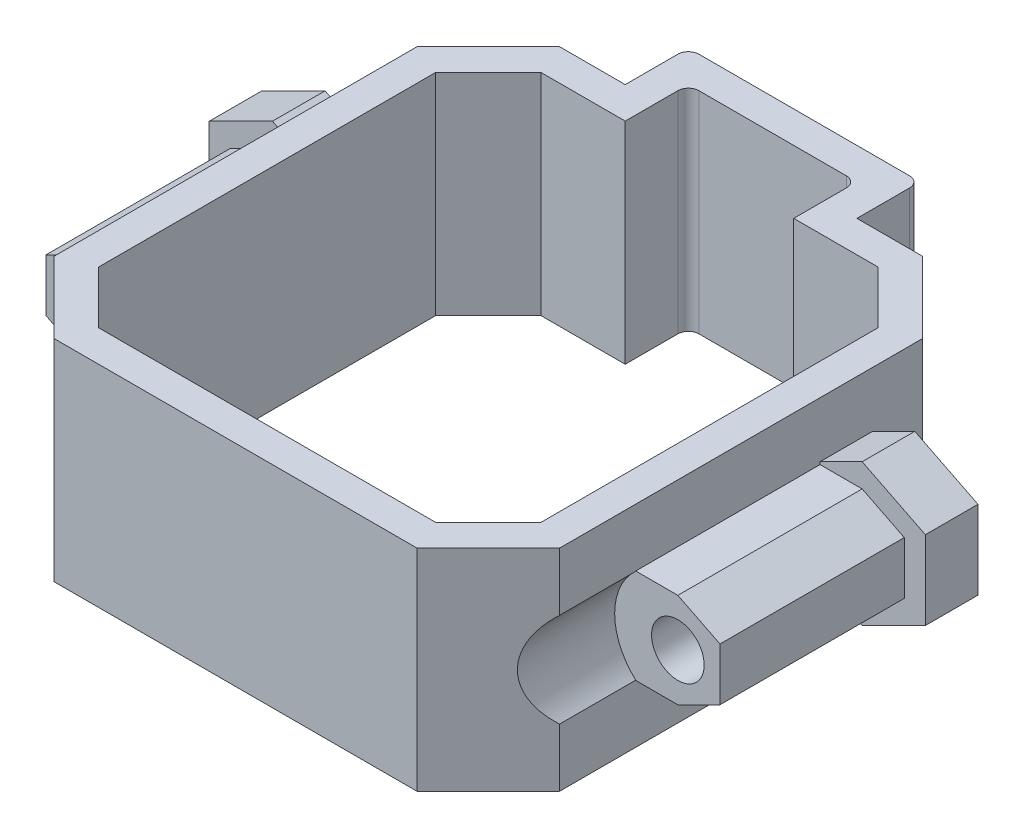
from build123d import *

# Parameters (mm, degrees)
RESSALTO_EXTRUS_O1_DEPTH = 10
RESSALTO_EXTRUS_O2_DEPTH = 10
CORTE_EXTRUS_O1_START    = 21
ESBO_O4_R                = 6
ESBO_O4_R_2              = 2.5
CORTE_EXTRUS_O1_DEPTH    = 21
RESSALTO_EXTRUS_O3_DEPTH = 2.5


with BuildPart() as part:
    # Esboço1 → Ressalto-extrusão1 (new, symmetric)
    with BuildSketch(Plane(origin=(0, 0, 0), x_dir=(1, 0, 0), z_dir=(0, 1, 0))):
        with BuildLine():
            Line((21, 16), (21, 0))
            Line((21, 0), (24, 0))
            Line((24, 0), (24, 17.242640687))
            Line((24, 17.242640687), (17.242640687, 24))
            Line((17.242640687, 24), (11, 24))
            Line((11, 24), (11, 29))
            ThreePointArc((11, 29), (10.707106781, 29.707106781), (10, 30))
            Line((10, 30), (0, 30))
            Line((0, 30), (-10, 30))
            ThreePointArc((-10, 30), (-10.707106781, 29.707106781), (-11, 29))
            Line((-11, 29), (-11, 24))
            Line((-11, 24), (-17.242640687, 24))
            Line((-17.242640687, 24), (-24, 17.242640687))
            Line((-24, 17.242640687), (-24, 0))
            Line((-24, 0), (-21, 0))
            Line((-21, 0), (-21, 16))
            Line((-21, 16), (-16, 21))
            Line((-16, 21), (-8, 21))
            Line((-8, 21), (-8, 26))
            ThreePointArc((-8, 26), (-7.707106781, 26.707106781), (-7, 27))
            Line((-7, 27), (0, 27))
            Line((0, 27), (7, 27))
            ThreePointArc((7, 27), (7.707106781, 26.707106781), (8, 26))
            Line((8, 26), (8, 21))
            Line((8, 21), (16, 21))
            Line((16, 21), (21, 16))
        make_face()
        Polygon((0, -21), (0, -24), (17.242640687, -24), (24, -17.242640687), (24, 0), (21, 0), (21, -16), (16, -21), align=None)
        Polygon((-17.242640687, -24), (0, -24), (0, -21), (-16, -21), (-21, -16), (-21, 0), (-24, 0), (-24, -17.242640687), align=None)
    extrude(amount=RESSALTO_EXTRUS_O1_DEPTH, both=True)

    # Esboço2 → Ressalto-extrusão2 (add, symmetric)
    with BuildSketch(Plane.XY):
        with BuildLine():
            Line((-24, 0), (-24, 4.5))
            Line((-24, 4.5), (-28, 4.5))
            Line((-28, 4.5), (-28, 2.5))
            ThreePointArc((-28, 2.5), (-26.232233047, 1.767766953), (-25.5, 0))
            Line((-25.5, 0), (-24, 0))
        make_face()
        with BuildLine():
            Line((-28, 2.5), (-28, 4.5))
            Line((-28, 4.5), (-32, 2.5))
            Line((-32, 2.5), (-32, 0))
            Line((-32, 0), (-30.5, 0))
            ThreePointArc((-30.5, 0), (-29.767766953, 1.767766953), (-28, 2.5))
        make_face()
        with BuildLine():
            Line((-24, -4.5), (-24, 0))
            Line((-24, 0), (-25.5, 0))
            ThreePointArc((-25.5, 0), (-28, -2.5), (-30.5, 0))
            Line((-30.5, 0), (-32, 0))
            Line((-32, 0), (-32, -2.5))
            Line((-32, -2.5), (-28, -4.5))
            Line((-28, -4.5), (-24, -4.5))
        make_face()
        with BuildLine():
            Line((32, 0), (30.5, 0))
            ThreePointArc((30.5, 0), (28, -2.5), (25.5, 0))
            Line((25.5, 0), (24, 0))
            Line((24, 0), (24, -4.5))
            Line((24, -4.5), (28, -4.5))
            Line((28, -4.5), (32, -2.5))
            Line((32, -2.5), (32, 0))
        make_face()
        with BuildLine():
            Line((24, 0), (25.5, 0))
            ThreePointArc((25.5, 0), (26.232233047, 1.767766953), (28, 2.5))
            Line((28, 2.5), (28, 4.5))
            Line((28, 4.5), (24, 4.5))
            Line((24, 4.5), (24, 0))
        make_face()
        with BuildLine():
            ThreePointArc((28, 2.5), (29.767766953, 1.767766953), (30.5, 0))
            Line((30.5, 0), (32, 0))
            Line((32, 0), (32, 2.5))
            Line((32, 2.5), (28, 4.5))
            Line((28, 4.5), (28, 2.5))
        make_face()
    extrude(amount=RESSALTO_EXTRUS_O2_DEPTH, both=True)

    # Esboço4 → Corte-extrusão1 (cut)
    # profile 1 of 3: a face of its own
    with BuildSketch(Plane.XY.offset(10).offset(CORTE_EXTRUS_O1_START)):
        with BuildLine():
            Line((-24, 4.472135955), (-24, -4.472135955))
            ThreePointArc((-24, -4.472135955), (-22.522774425, -2.449489743), (-22, 0))
            ThreePointArc((-22, 0), (-22.522774425, 2.449489743), (-24, 4.472135955))
        make_face()
    # profile 2 of 3: a face of its own
    with BuildSketch(Plane.XY.offset(10).offset(CORTE_EXTRUS_O1_START)):
        with Locations((28, 0)):
            Circle(ESBO_O4_R)
        with Locations((28, 0)):
            Circle(ESBO_O4_R_2, mode=Mode.SUBTRACT)
    # profile 3 of 3: a face of its own
    with BuildSketch(Plane.XY.offset(10).offset(CORTE_EXTRUS_O1_START)):
        with Locations((28, 0)):
            Circle(ESBO_O4_R_2)
    extrude(amount=-CORTE_EXTRUS_O1_DEPTH, mode=Mode.SUBTRACT)

    # Esboço5 → Ressalto-extrusão3 (add, symmetric)
    # profile 1 of 4: a face of its own
    with BuildSketch(Plane(origin=(0, 0, -10), x_dir=(-1, 0, 0), z_dir=(0, 0, -1))):
        Polygon((-28, 6.736067977), (-22, 3.736067977), (-22, -3.736067977), (-28, -6.736067977), (-34, -3.736067977), (-34, 3.736067977), align=None)
        Polygon((-28, 4.5), (-32, 2.5), (-32, -2.5), (-28, -4.5), (-24, -4.5), (-24, 4.5), align=None, mode=Mode.SUBTRACT)
    # profile 2 of 4: a face of its own
    with BuildSketch(Plane(origin=(0, 0, -10), x_dir=(-1, 0, 0), z_dir=(0, 0, -1))):
        Polygon((-24, 4.5), (-28, 4.5), (-24, 2.5), align=None)
    # profile 3 of 4: a face of its own
    with BuildSketch(Plane(origin=(0, 0, -10), x_dir=(-1, 0, 0), z_dir=(0, 0, -1))):
        Polygon((-24, -2.5), (-28, -4.5), (-24, -4.5), align=None)
    # profile 4 of 4: a face of its own
    with BuildSketch(Plane(origin=(0, 0, -10), x_dir=(-1, 0, 0), z_dir=(0, 0, -1))):
        Polygon((28, 6.736067977), (34, 3.736067977), (34, -3.736067977), (28, -6.736067977), (22, -3.736067977), (22, 3.736067977), align=None)
        Polygon((28, 4.5), (32, 2.5), (32, -2.5), (28, -4.5), (24, -2.5), (24, 2.5), align=None, mode=Mode.SUBTRACT)
    extrude(amount=RESSALTO_EXTRUS_O3_DEPTH, both=True)


solid = part.part
